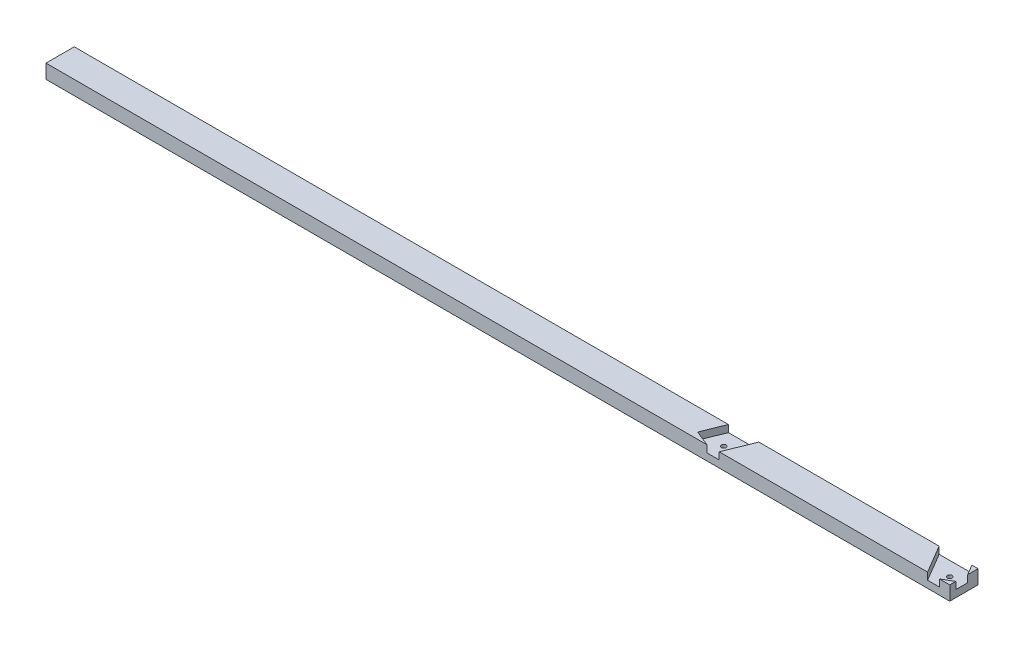
from build123d import *

# Parameters (mm, degrees)
SKETCH2_W           = 1219.2
SKETCH2_H           = 38.1
BOSS_EXTRUDE2_DEPTH = 19.05
SKETCH3_R           = 3.175
CUT_EXTRUDE1_DEPTH  = 19.05
SKETCH4_R           = 3.175
CUT_EXTRUDE2_DEPTH  = 9.525


with BuildPart() as part:
    # Sketch2 → Boss-Extrude2 (new body)
    with BuildSketch(Plane(origin=(0, 0, 0), x_dir=(1, 0, 0), z_dir=(0, 1, 0))):
        with Locations((-609.6, -19.05)):
            Rectangle(SKETCH2_W, SKETCH2_H)
    extrude(amount=BOSS_EXTRUDE2_DEPTH)

    # Sketch3 → Cut-Extrude1 (cut)
    with BuildSketch(Plane(origin=(0, 19.05, 0), x_dir=(1, 0, 0), z_dir=(0, 1, 0))):
        with Locations((-19.05, -19.05)):
            Circle(SKETCH3_R)
        with Locations((-323.85, -19.05)):
            Circle(SKETCH3_R)
    extrude(amount=-CUT_EXTRUDE1_DEPTH, mode=Mode.SUBTRACT)

    # Sketch4 → Cut-Extrude2 (cut)
    # profile 1 of 2: a face of its own
    with BuildSketch(Plane(origin=(0, 19.05, 0), x_dir=(1, 0, 0), z_dir=(0, 1, 0))):
        Polygon((-336.69350738, 0), (-348.653572647, -29.566072647), (-327.557139607, -38.1), (-311.00649262, -38.1), (-295.594283764, 0), align=None)
        with Locations((-323.85, -19.05)):
            Circle(SKETCH4_R, mode=Mode.SUBTRACT)
    # profile 2 of 2: a face of its own
    with BuildSketch(Plane(origin=(0, 19.05, 0), x_dir=(1, 0, 0), z_dir=(0, 1, 0))):
        Polygon((-52.443119188, 0), (-29.917583168, -38.1), (-13.839851848, -38.1), (0, -29.917583168), (0, -13.839851848), (-8.182416832, 0), align=None)
        with Locations((-19.05, -19.05)):
            Circle(SKETCH4_R, mode=Mode.SUBTRACT)
    extrude(amount=-CUT_EXTRUDE2_DEPTH, mode=Mode.SUBTRACT)


solid = part.part
